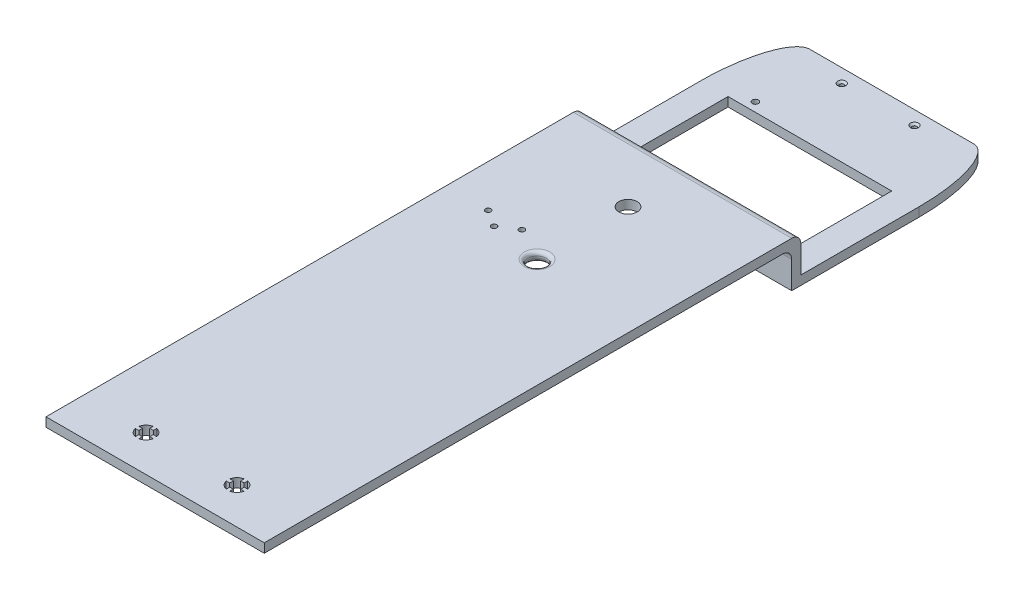
from build123d import *

# Parameters (mm, degrees)
SKETCH1_W                                       = 5
SKETCH1_H                                       = 25
SKETCH1_W_2                                     = 110
SKETCH1_H_2                                     = 5
SKETCH1_W_3                                     = 290
BOSS_EXTRUDE1_DEPTH                             = 120
SKETCH2_W                                       = 90
SKETCH2_H                                       = 65
SKETCH2_R                                       = 5
CUT_EXTRUDE1_DEPTH                              = 320.452656899
CSK_FOR_M2_FLAT_HEAD_MACHINE_SCREW1_D           = 2.4
CSK_FOR_M2_FLAT_HEAD_MACHINE_SCREW1_CSINK_D     = 4.4
CSK_FOR_M2_FLAT_HEAD_MACHINE_SCREW1_CSINK_ANGLE = 90
F_3_0MM_DOWEL_HOLE1_D                           = 3
BOSS_EXTRUDE2_DEPTH                             = 120
SKETCH10_W                                      = 36.666666667
SKETCH10_H                                      = 20
SKETCH10_W_2                                    = 36.666666666
CUT_EXTRUDE2_DEPTH                              = 290
FILLET1_R                                       = 5
CSK_FOR_M3_FLAT_HEAD_MACHINE_SCREW1_D           = 3.4
CSK_FOR_M3_FLAT_HEAD_MACHINE_SCREW1_DEPTH       = 5
CSK_FOR_M3_FLAT_HEAD_MACHINE_SCREW1_CSINK_D     = 6.3
CSK_FOR_M3_FLAT_HEAD_MACHINE_SCREW1_CSINK_ANGLE = 90
CSK_FOR_M3_FLAT_HEAD_MACHINE_SCREW1_TIP         = 1.021463052
FILLET2_R                                       = 2


with BuildPart() as part:
    # Sketch1 → Boss-Extrude1 (new body)
    with BuildSketch(Plane(origin=(0, 0, 0), x_dir=(0, 0, -1), z_dir=(1, 0, 0))):
        with Locations((-2.5, 12.5)):
            Rectangle(SKETCH1_W, SKETCH1_H)
        with Locations((55, 2.5)):
            Rectangle(SKETCH1_W_2, SKETCH1_H_2)
        with Locations((-150, 22.5)):
            Rectangle(SKETCH1_W_3, SKETCH1_H_2)
    extrude(amount=BOSS_EXTRUDE1_DEPTH)

    # Sketch2 → Cut-Extrude1 (cut, through all)
    with BuildSketch(Plane(origin=(0, 25, 0), x_dir=(1, 0, 0), z_dir=(0, 1, 0))):
        with BuildLine():
            Line((34, -272), (34, -270.101020514))
            ThreePointArc((34, -270.101020514), (31.464466094, -271.464466094), (30.101020514, -274))
            Line((30.101020514, -274), (32, -274))
            Line((32, -274), (32, -276))
            Line((32, -276), (30.101020514, -276))
            ThreePointArc((30.101020514, -276), (31.464466094, -278.535533906), (34, -279.898979486))
            Line((34, -279.898979486), (34, -278))
            Line((34, -278), (36, -278))
            Line((36, -278), (36, -279.898979486))
            ThreePointArc((36, -279.898979486), (38.535533906, -278.535533906), (39.898979486, -276))
            Line((39.898979486, -276), (38, -276))
            Line((38, -276), (38, -274))
            Line((38, -274), (39.898979486, -274))
            ThreePointArc((39.898979486, -274), (38.535533906, -271.464466094), (36, -270.101020514))
            Line((36, -270.101020514), (36, -272))
            Line((36, -272), (34, -272))
        make_face()
        with BuildLine():
            Line((84, -272), (84, -270.101020514))
            ThreePointArc((84, -270.101020514), (81.464466094, -271.464466094), (80.101020514, -274))
            Line((80.101020514, -274), (82, -274))
            Line((82, -274), (82, -276))
            Line((82, -276), (80.101020514, -276))
            ThreePointArc((80.101020514, -276), (81.464466094, -278.535533906), (84, -279.898979486))
            Line((84, -279.898979486), (84, -278))
            Line((84, -278), (86, -278))
            Line((86, -278), (86, -279.898979486))
            ThreePointArc((86, -279.898979486), (88.535533906, -278.535533906), (89.898979486, -276))
            Line((89.898979486, -276), (88, -276))
            Line((88, -276), (88, -274))
            Line((88, -274), (89.898979486, -274))
            ThreePointArc((89.898979486, -274), (88.535533906, -271.464466094), (86, -270.101020514))
            Line((86, -270.101020514), (86, -272))
            Line((86, -272), (84, -272))
        make_face()
        with Locations((60, 32.5)):
            Rectangle(SKETCH2_W, SKETCH2_H)
        with BuildLine():
            Line((-14.667196701, 131.62219227), (15, 110))
            add(Edge.make_bspline(
                [(15, 110), (0, 110), (0, 65)],
                knots=[0, 0, 0, 1.570796327, 1.570796327, 1.570796327], degree=2, weights=[1, 0.707106781, 1]))
            Line((0, 65), (-14.667196701, 131.62219227))
        make_face()
        with BuildLine():
            add(Edge.make_bspline(
                [(120, 65), (120, 110), (105, 110)],
                knots=[4.71238898, 4.71238898, 4.71238898, 6.283185307, 6.283185307, 6.283185307], degree=2, weights=[1, 0.707106781, 1]))
            Line((105, 110), (141.916619914, 126.007078186))
            Line((141.916619914, 126.007078186), (120, 65))
        make_face()
        with Locations(Location((60, -35, 0), (0, 0, 270))):
            Circle(SKETCH2_R)
        with Locations(Location((60, -85, 0), (0, 0, 270))):
            Circle(SKETCH2_R)
    extrude(amount=-CUT_EXTRUDE1_DEPTH, mode=Mode.SUBTRACT)

    # CSK for M2 Flat Head Machine Screw1 (through all)
    with Locations(Plane(origin=(0, 5, 0), x_dir=(1, 0, 0), z_dir=(0, 1, 0))):
        with Locations((40, 102.5), (80, 102.5)):
            CounterSinkHole(CSK_FOR_M2_FLAT_HEAD_MACHINE_SCREW1_D / 2, CSK_FOR_M2_FLAT_HEAD_MACHINE_SCREW1_CSINK_D / 2, counter_sink_angle=CSK_FOR_M2_FLAT_HEAD_MACHINE_SCREW1_CSINK_ANGLE)

    # Ø3.0mm Dowel Hole1 (through all)
    with Locations(Plane(origin=(0, 25, 0), x_dir=(1, 0, 0), z_dir=(0, 1, 0))):
        with Locations((23.25, -75.11), (32.5, -81.11), (41.75, -75.11)):
            Hole(F_3_0MM_DOWEL_HOLE1_D / 2)

    # Sketch9 → Boss-Extrude2 (add)
    with BuildSketch(Plane.ZY):
        Polygon((5, 0), (25, 20), (5, 20), align=None)
    extrude(amount=-BOSS_EXTRUDE2_DEPTH)

    # Sketch10 → Cut-Extrude2 (cut)
    with BuildSketch(Plane.XY.offset(295)):
        with Locations((18.333333334, 10)):
            Rectangle(SKETCH10_W, SKETCH10_H)
        with Locations((60, 10)):
            Rectangle(SKETCH10_W_2, SKETCH10_H)
        with Locations((101.666666667, 10)):
            Rectangle(SKETCH10_W, SKETCH10_H)
    extrude(amount=-CUT_EXTRUDE2_DEPTH, mode=Mode.SUBTRACT)

    # Fillet1
    fillet1_edges = [part.edges().sort_by_distance(p)[0] for p in [
        (60, 25, 0),
        (18.333333333, 20, 5),
        (60, 20, 5),
        (101.666666667, 20, 5),
    ]]
    fillet(fillet1_edges, radius=FILLET1_R)

    # CSK for M3 Flat Head Machine Screw1
    with Locations(Plane.XZ):
        with Locations((25, -70)):
            CounterSinkHole(CSK_FOR_M3_FLAT_HEAD_MACHINE_SCREW1_D / 2, CSK_FOR_M3_FLAT_HEAD_MACHINE_SCREW1_CSINK_D / 2, depth=CSK_FOR_M3_FLAT_HEAD_MACHINE_SCREW1_DEPTH, counter_sink_angle=CSK_FOR_M3_FLAT_HEAD_MACHINE_SCREW1_CSINK_ANGLE)
            with Locations((0, 0, -(CSK_FOR_M3_FLAT_HEAD_MACHINE_SCREW1_DEPTH + CSK_FOR_M3_FLAT_HEAD_MACHINE_SCREW1_TIP / 2))):  # 118° drill point
                Cone(0, CSK_FOR_M3_FLAT_HEAD_MACHINE_SCREW1_D / 2, CSK_FOR_M3_FLAT_HEAD_MACHINE_SCREW1_TIP, mode=Mode.SUBTRACT)

    # Fillet2
    fillet2_edges = [part.edges().sort_by_distance(p)[0] for p in [
        (60, 20, 80),
        (60, 25, 80),
    ]]
    fillet(fillet2_edges, radius=FILLET2_R)


solid = part.part
